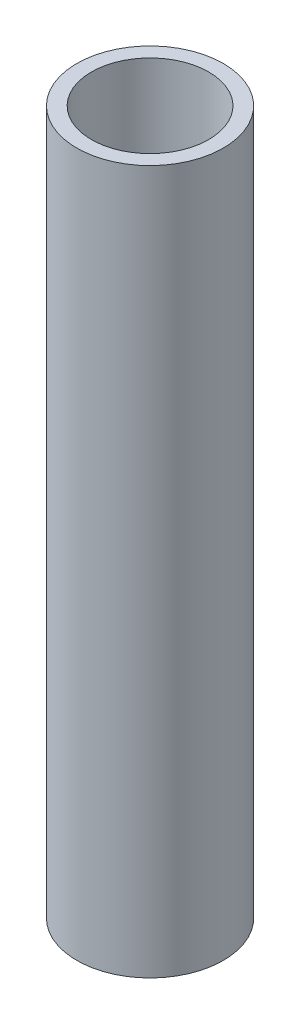
from build123d import *

# Parameters (mm, degrees)
SKETCH2_R           = 7.9375
SKETCH2_R_2         = 6.35
BOSS_EXTRUDE1_DEPTH = 76.2


with BuildPart() as part:
    # Sketch2 → Boss-Extrude1 (new body)
    with BuildSketch(Plane(origin=(0, 0, 0), x_dir=(1, 0, 0), z_dir=(0, 1, 0))):
        with Locations(Location((0, 0, 0), (0, 0, 90))):
            Circle(SKETCH2_R)
        with Locations(Location((0, 0, 0), (0, 0, 90))):
            Circle(SKETCH2_R_2, mode=Mode.SUBTRACT)
    extrude(amount=BOSS_EXTRUDE1_DEPTH)


solid = part.part
